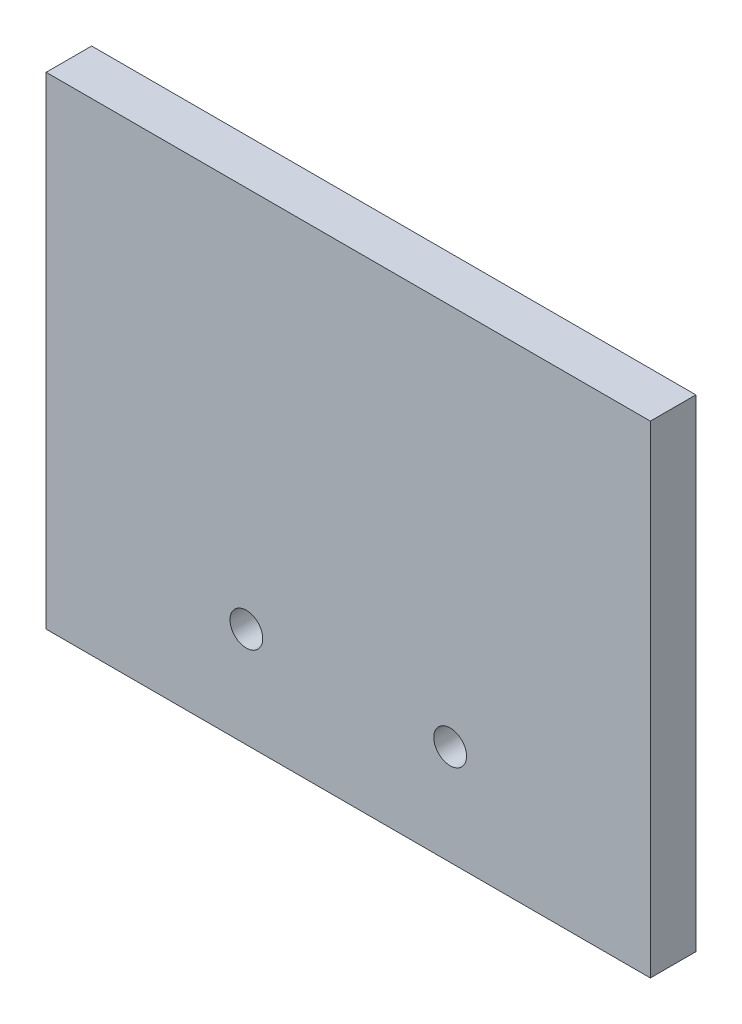
from build123d import *

# Parameters (mm, degrees)
SKETCH1_W                = 50
SKETCH1_H                = 9.1
BOSS_EXTRUDE1_DEPTH      = 2
SKETCH2_W                = 25
SKETCH2_H                = 6.6
CUT_EXTRUDE1_DEPTH       = 2
SKETCH3_R                = 1.8
CUT_EXTRUDE2_DEPTH       = 2
SKETCH4_W                = 66.4
SKETCH4_H                = 130
BOSS_EXTRUDE2_DEPTH      = 2
SKETCH5_W                = 66.4
SKETCH5_H                = 2
BOSS_EXTRUDE3_DEPTH      = 2.5
SKETCH6_W                = 8.6
SKETCH6_H                = 62.5
BOSS_EXTRUDE4_DEPTH      = 2
SKETCH7_R                = 1.8
SKETCH7_W                = 3
SKETCH7_H                = 5
CUT_EXTRUDE3_DEPTH       = 2
SKETCH8_W                = 25
SKETCH8_H                = 45
CUT_EXTRUDE4_DEPTH       = 20
SKETCH9_W                = 25
SKETCH9_H                = 10
BOSS_EXTRUDE5_DEPTH      = 2
SKETCH10_W               = 34.7
SKETCH10_H               = 27.07
BOSS_EXTRUDE6_DEPTH      = 2
SKETCH11_R               = 1.8
CUT_EXTRUDE5_DEPTH       = 2
SKETCH12_R               = 1.8
CUT_EXTRUDE6_DEPTH       = 2
SKETCH13_W               = 2
SKETCH13_H               = 2
BOSS_EXTRUDE7_DEPTH      = 44
SKETCH14_W               = 2
SKETCH14_H               = 2
BOSS_EXTRUDE8_DEPTH      = 46
SKETCH16_W               = 42
SKETCH16_H               = 43
BOSS_EXTRUDE10_DEPTH     = 2
SKETCH18_R               = 1.8
CUT_EXTRUDE7_DEPTH       = 2
BOSS_EXTRUDE12_DEPTH     = 2
SKETCH21_W               = 2
SKETCH21_H               = 2
BOSS_EXTRUDE13_DEPTH     = 10
SKETCH25_W               = 3
SKETCH25_H               = 5
CUT_EXTRUDE8_DEPTH       = 10
SKETCH26_W               = 6.2
SKETCH26_H               = 13
SKETCH26_W_2             = 21
SKETCH26_H_2             = 6.6
BOSS_EXTRUDE14_DEPTH     = 2
SKETCH27_W               = 2
SKETCH27_H               = 27
SKETCH27_H_2             = 24.93
BOSS_EXTRUDE15_DEPTH     = 2
SKETCH29_W               = 10
SKETCH29_H               = 10
BOSS_EXTRUDE19_DEPTH     = 2
SKETCH41_R               = 1.8
CUT_EXTRUDE15_DEPTH      = 2
BOSS_EXTRUDE26_DEPTH     = 2
SKETCH43_W               = 70.4
SKETCH43_H               = 2
BOSS_EXTRUDE27_DEPTH     = 11
SKETCH44_W               = 10
SKETCH44_H               = 5
BOSS_EXTRUDE28_DEPTH     = 2
SKETCH45_R               = 1.8
BOSS_EXTRUDE29_DEPTH     = 2
SKETCH46_R               = 1.8
CUT_EXTRUDE16_DEPTH      = 2
SKETCH47_W               = 10
SKETCH47_H               = 1
BOSS_EXTRUDE30_DEPTH     = 2
SKETCH48_W               = 32.7
SKETCH48_H               = 31.07
SKETCH48_W_2             = 101.75
SKETCH48_H_2             = 120.487369876
CUT_EXTRUDE17_DEPTH      = 20
SKETCH50_W               = 66.4
SKETCH50_H               = 81.07
CUT_EXTRUDE19_DEPTH      = 20
SKETCH51_W               = 70.4
SKETCH51_H               = 85.07
SKETCH51_W_2             = 66.4
SKETCH51_H_2             = 81.07
BOSS_EXTRUDE31_DEPTH     = 20
SKETCH52_W               = 10
SKETCH52_H               = 1
BOSS_EXTRUDE32_DEPTH     = 2
SKETCH53_W               = 10
SKETCH53_H               = 4
CUT_EXTRUDE20_DEPTH      = 2
BOSS_EXTRUDE33_START     = 1
SKETCH54_W               = 10
SKETCH54_H               = 12
SKETCH54_R               = 1.8
BOSS_EXTRUDE33_DEPTH     = 1
CUT_EXTRUDE23_DEPTH      = 96
CUT_EXTRUDE23_DEPTH_BACK = 16
SKETCH59_R               = 1.8
SKETCH62_W               = 66.985033768
SKETCH62_H               = 11.249394984
BOSS_EXTRUDE38_DEPTH     = 1
SKETCH65_R               = 1.8
CUT_EXTRUDE27_DEPTH      = 3
SKETCH66_R               = 1
CUT_EXTRUDE28_DEPTH      = 87
BOSS_EXTRUDE41_DEPTH     = 2
BOSS_EXTRUDE42_DEPTH     = 2
BOSS_EXTRUDE43_DEPTH     = 2
SKETCH68_W               = 6.791832398
SKETCH68_H               = 8.144168394
SKETCH68_W_2             = 5.485710784
SKETCH68_W_3             = 7.764004839
SKETCH68_H_2             = 11.628907231
BOSS_EXTRUDE44_DEPTH     = 2
BOSS_EXTRUDE45_DEPTH     = 2
SKETCH70_R               = 1.8
CUT_EXTRUDE29_DEPTH      = 83
SKETCH72_W               = 109.694125273
SKETCH72_H               = 49.124079095
CUT_EXTRUDE30_DEPTH      = 90
SKETCH73_W               = 16.906531278
SKETCH73_H               = 38.825332728
SKETCH73_W_2             = 13.856512057
SKETCH73_H_2             = 35.444026473
CUT_EXTRUDE31_DEPTH      = 90
SKETCH74_W               = 66.4
SKETCH74_H               = 2
BOSS_EXTRUDE46_DEPTH     = 31
BOSS_EXTRUDE47_START     = 3
SKETCH75_W               = 66.4
SKETCH75_H               = 53
SKETCH75_R               = 1.8
BOSS_EXTRUDE47_DEPTH     = 3


with BuildPart() as part:
    # Sketch1 → Boss-Extrude1 (new body)
    with BuildSketch(Plane(origin=(0, 0, 0), x_dir=(1, 0, 0), z_dir=(0, 1, 0))):
        with Locations((25, 4.55)):
            Rectangle(SKETCH1_W, SKETCH1_H)
    extrude(amount=BOSS_EXTRUDE1_DEPTH)

    # Sketch2 → Cut-Extrude1 (cut)
    with BuildSketch(Plane(origin=(0, 2, 0), x_dir=(1, 0, 0), z_dir=(0, 1, 0))):
        with Locations((25, 5.8)):
            Rectangle(SKETCH2_W, SKETCH2_H)
    extrude(amount=-CUT_EXTRUDE1_DEPTH, mode=Mode.SUBTRACT)

    # Sketch3 → Cut-Extrude2 (cut)
    with BuildSketch(Plane(origin=(0, 2, 0), x_dir=(1, 0, 0), z_dir=(0, 1, 0))):
        with Locations(Location((6.25, 5.8, 0), (0, 0, 270))):
            Circle(SKETCH3_R)
        with Locations(Location((43.75, 5.8, 0), (0, 0, 270))):
            Circle(SKETCH3_R)
    extrude(amount=-CUT_EXTRUDE2_DEPTH, mode=Mode.SUBTRACT)

    # Sketch4 → Boss-Extrude2 (add)
    with BuildSketch(Plane(origin=(0, 2, 0), x_dir=(1, 0, 0), z_dir=(0, 1, 0))):
        with Locations((25, -65)):
            Rectangle(SKETCH4_W, SKETCH4_H)
    extrude(amount=-BOSS_EXTRUDE2_DEPTH)

    # Sketch5 → Boss-Extrude3 (add)
    with BuildSketch(Plane.XY.offset(130)):
        with Locations((25, 1)):
            Rectangle(SKETCH5_W, SKETCH5_H)
    extrude(amount=BOSS_EXTRUDE3_DEPTH)

    # Sketch6 → Boss-Extrude4 (add)
    with BuildSketch(Plane(origin=(0, 2, 0), x_dir=(1, 0, 0), z_dir=(0, 1, 0))):
        with Locations((-12.5, -101.25)):
            Rectangle(SKETCH6_W, SKETCH6_H)
        with Locations((62.5, -101.25)):
            Rectangle(SKETCH6_W, SKETCH6_H)
    extrude(amount=-BOSS_EXTRUDE4_DEPTH)

    # Sketch7 → Cut-Extrude3 (cut)
    with BuildSketch(Plane(origin=(0, 2, 0), x_dir=(1, 0, 0), z_dir=(0, 1, 0))):
        with Locations(Location((-13.5, -77, 0), (0, 0, 270))):
            Circle(SKETCH7_R)
        with Locations(Location((-13.5, -101.25, 0), (0, 0, 270))):
            Circle(SKETCH7_R)
        with Locations(Location((-13.5, -125.5, 0), (0, 0, 270))):
            Circle(SKETCH7_R)
        with Locations(Location((63.5, -77, 0), (0, 0, 270))):
            Circle(SKETCH7_R)
        with Locations(Location((63.5, -101.25, 0), (0, 0, 270))):
            Circle(SKETCH7_R)
        with Locations(Location((63.5, -125.5, 0), (0, 0, 270))):
            Circle(SKETCH7_R)
        with Locations((-13.5, -117.5)):
            Rectangle(SKETCH7_W, SKETCH7_H)
        with Locations((63.5, -117.5)):
            Rectangle(SKETCH7_W, SKETCH7_H)
    extrude(amount=-CUT_EXTRUDE3_DEPTH, mode=Mode.SUBTRACT)

    # Sketch8 → Cut-Extrude4 (cut)
    with BuildSketch(Plane(origin=(0, 2, 0), x_dir=(1, 0, 0), z_dir=(0, 1, 0))):
        with Locations((25, -22.5)):
            Rectangle(SKETCH8_W, SKETCH8_H)
    extrude(amount=-CUT_EXTRUDE4_DEPTH, mode=Mode.SUBTRACT)

    # Sketch9 → Boss-Extrude5 (add)
    with BuildSketch(Plane(origin=(0, 2, 0), x_dir=(1, 0, 0), z_dir=(0, 1, 0))):
        with Locations((25, -5)):
            Rectangle(SKETCH9_W, SKETCH9_H)
    extrude(amount=-BOSS_EXTRUDE5_DEPTH)

    # Sketch10 → Boss-Extrude6 (add)
    with BuildSketch(Plane(origin=(0, 2, 0), x_dir=(1, 0, 0), z_dir=(0, 1, 0))):
        with Locations((-25.55, -29.535)):
            Rectangle(SKETCH10_W, SKETCH10_H)
        with Locations((75.55, -29.535)):
            Rectangle(SKETCH10_W, SKETCH10_H)
    extrude(amount=-BOSS_EXTRUDE6_DEPTH)

    # Sketch11 → Cut-Extrude5 (cut)
    with BuildSketch(Plane(origin=(0, 2, 0), x_dir=(1, 0, 0), z_dir=(0, 1, 0))):
        with Locations(Location((-36.9, -19.25, 0), (0, 0, 270))):
            Circle(SKETCH11_R)
        with Locations(Location((-36.9, -39.82, 0), (0, 0, 270))):
            Circle(SKETCH11_R)
        with Locations(Location((-22.6, -19.25, 0), (0, 0, 270))):
            Circle(SKETCH11_R)
        with Locations(Location((-22.6, -39.82, 0), (0, 0, 270))):
            Circle(SKETCH11_R)
    extrude(amount=-CUT_EXTRUDE5_DEPTH, mode=Mode.SUBTRACT)

    # Sketch12 → Cut-Extrude6 (cut)
    with BuildSketch(Plane(origin=(0, 2, 0), x_dir=(1, 0, 0), z_dir=(0, 1, 0))):
        with Locations(Location((72.6, -19.25, 0), (0, 0, 270))):
            Circle(SKETCH12_R)
        with Locations(Location((86.9, -19.25, 0), (0, 0, 270))):
            Circle(SKETCH12_R)
        with Locations(Location((72.6, -39.82, 0), (0, 0, 270))):
            Circle(SKETCH12_R)
        with Locations(Location((86.9, -39.82, 0), (0, 0, 270))):
            Circle(SKETCH12_R)
    extrude(amount=-CUT_EXTRUDE6_DEPTH, mode=Mode.SUBTRACT)

    # Sketch13 → Boss-Extrude7 (add)
    with BuildSketch(Plane.ZY.offset(42.9)):
        with Locations((15, 1)):
            Rectangle(SKETCH13_W, SKETCH13_H)
        with Locations((44.07, 1)):
            Rectangle(SKETCH13_W, SKETCH13_H)
    extrude(amount=-BOSS_EXTRUDE7_DEPTH)

    # Sketch14 → Boss-Extrude8 (add)
    with BuildSketch(Plane(origin=(92.9, 0, 0), x_dir=(0, 0, -1), z_dir=(1, 0, 0))):
        with Locations((-15, 1)):
            Rectangle(SKETCH14_W, SKETCH14_H)
        with Locations((-44.07, 1)):
            Rectangle(SKETCH14_W, SKETCH14_H)
    extrude(amount=-BOSS_EXTRUDE8_DEPTH)

    # Sketch16 → Boss-Extrude10 (add)
    with BuildSketch(Plane(origin=(0, 2, 0), x_dir=(1, 0, 0), z_dir=(0, 1, 0))):
        with Locations((25, -154)):
            Rectangle(SKETCH16_W, SKETCH16_H)
    extrude(amount=-BOSS_EXTRUDE10_DEPTH)

    # Sketch18 → Cut-Extrude7 (cut)
    with BuildSketch(Plane(origin=(0, 2, 0), x_dir=(1, 0, 0), z_dir=(0, 1, 0))):
        with Locations(Location((8.74, -171.03, 0), (0, 0, 270))):
            Circle(SKETCH18_R)
        with Locations(Location((41.26, -171.03, 0), (0, 0, 270))):
            Circle(SKETCH18_R)
        with Locations(Location((8.74, -138.5, 0), (0, 0, 270))):
            Circle(SKETCH18_R)
        with Locations(Location((41.26, -138.5, 0), (0, 0, 270))):
            Circle(SKETCH18_R)
    extrude(amount=-CUT_EXTRUDE7_DEPTH, mode=Mode.SUBTRACT)

    # Sketch20 → Boss-Extrude12 (add)
    with BuildSketch(Plane(origin=(0, 2, 0), x_dir=(1, 0, 0), z_dir=(0, 1, 0))):
        with BuildLine():
            Line((-2, -132.5), (4, -132.5))
            Line((4, -132.5), (4, -138.5))
            ThreePointArc((4, -138.5), (2.242640687, -134.257359313), (-2, -132.5))
        make_face()
        with BuildLine():
            ThreePointArc((52, -132.5), (47.757359313, -134.257359313), (46, -138.5))
            Line((46, -138.5), (46, -132.5))
            Line((46, -132.5), (52, -132.5))
        make_face()
    extrude(amount=-BOSS_EXTRUDE12_DEPTH)

    # Sketch21 → Boss-Extrude13 (add)
    with BuildSketch(Plane(origin=(0, 0, -9.1), x_dir=(-1, 0, 0), z_dir=(0, 0, -1))):
        with Locations((-51, 1)):
            Rectangle(SKETCH21_W, SKETCH21_H)
        with Locations((-36.5, 1)):
            Rectangle(SKETCH21_W, SKETCH21_H)
        with Locations((-13.5, 1)):
            Rectangle(SKETCH21_W, SKETCH21_H)
        with Locations((1, 1)):
            Rectangle(SKETCH21_W, SKETCH21_H)
    extrude(amount=-BOSS_EXTRUDE13_DEPTH)

    # Sketch25 → Cut-Extrude8 (cut)
    with BuildSketch(Plane(origin=(0, 2, 0), x_dir=(1, 0, 0), z_dir=(0, 1, 0))):
        with Locations((-11.7, -22.5)):
            Rectangle(SKETCH25_W, SKETCH25_H)
        with Locations((-11.7, -36.57)):
            Rectangle(SKETCH25_W, SKETCH25_H)
        with Locations((61.7, -22.5)):
            Rectangle(SKETCH25_W, SKETCH25_H)
        with Locations((61.7, -36.57)):
            Rectangle(SKETCH25_W, SKETCH25_H)
    extrude(amount=-CUT_EXTRUDE8_DEPTH, mode=Mode.SUBTRACT)

    # Sketch26 → Boss-Extrude14 (add)
    with BuildSketch(Plane(origin=(0, 2, 0), x_dir=(1, 0, 0), z_dir=(0, 1, 0))):
        with Locations((-5.1, 6.5)):
            Rectangle(SKETCH26_W, SKETCH26_H)
        Polygon((-2, 13), (-2, 9.1), (14.5, 9.1), (35.5, 9.1), (52, 9.1), (52, 13), align=None)
        with Locations((25, 5.8)):
            Rectangle(SKETCH26_W_2, SKETCH26_H_2)
        with Locations((55.1, 6.5)):
            Rectangle(SKETCH26_W, SKETCH26_H)
    extrude(amount=-BOSS_EXTRUDE14_DEPTH)

    # Sketch27 → Boss-Extrude15 (add)
    with BuildSketch(Plane(origin=(0, 2, 0), x_dir=(1, 0, 0), z_dir=(0, 1, 0))):
        with Locations((-9.2, -0.5)):
            Rectangle(SKETCH27_W, SKETCH27_H)
        with Locations((-9.2, -57.535)):
            Rectangle(SKETCH27_W, SKETCH27_H_2)
        with Locations((59.2, -0.5)):
            Rectangle(SKETCH27_W, SKETCH27_H)
        with Locations((59.2, -57.535)):
            Rectangle(SKETCH27_W, SKETCH27_H_2)
    extrude(amount=-BOSS_EXTRUDE15_DEPTH)

    # Sketch29 → Boss-Extrude19 (add)
    with BuildSketch(Plane(origin=(0, 2, 0), x_dir=(1, 0, 0), z_dir=(0, 1, 0))):
        with Locations((-15.2, -9)):
            Rectangle(SKETCH29_W, SKETCH29_H)
        with Locations((-15.2, -50.07)):
            Rectangle(SKETCH29_W, SKETCH29_H)
        with Locations((65.2, -9)):
            Rectangle(SKETCH29_W, SKETCH29_H)
        with Locations((65.2, -50.07)):
            Rectangle(SKETCH29_W, SKETCH29_H)
    extrude(amount=-BOSS_EXTRUDE19_DEPTH)

    # Sketch41 → Cut-Extrude15 (cut)
    with BuildSketch(Plane(origin=(0, 2, 0), x_dir=(1, 0, 0), z_dir=(0, 1, 0))):
        with Locations(Location((-15.2, -9, 0), (0, 0, 270))):
            Circle(SKETCH41_R)
        with Locations(Location((-15.2, -50.07, 0), (0, 0, 270))):
            Circle(SKETCH41_R)
        with Locations(Location((65.2, -9, 0), (0, 0, 270))):
            Circle(SKETCH41_R)
        with Locations(Location((65.2, -50.07, 0), (0, 0, 270))):
            Circle(SKETCH41_R)
    extrude(amount=-CUT_EXTRUDE15_DEPTH, mode=Mode.SUBTRACT)

    # Sketch42 → Boss-Extrude26 (add)
    with BuildSketch(Plane(origin=(0, 2, 0), x_dir=(1, 0, 0), z_dir=(0, 1, 0))):
        with BuildLine():
            Line((-16.8, -70), (-10.2, -70))
            Line((-10.2, -70), (-10.2, -63.4))
            ThreePointArc((-10.2, -63.4), (-12.133095244, -68.066904756), (-16.8, -70))
        make_face()
        with BuildLine():
            Line((60.2, -63.4), (60.2, -70))
            Line((60.2, -70), (66.8, -70))
            ThreePointArc((66.8, -70), (62.133095244, -68.066904756), (60.2, -63.4))
        make_face()
    extrude(amount=-BOSS_EXTRUDE26_DEPTH)

    # Sketch43 → Boss-Extrude27 (add)
    with BuildSketch(Plane(origin=(0, 0, -13), x_dir=(-1, 0, 0), z_dir=(0, 0, -1))):
        with Locations((-25, 1)):
            Rectangle(SKETCH43_W, SKETCH43_H)
    extrude(amount=BOSS_EXTRUDE27_DEPTH)

    # Sketch44 → Boss-Extrude28 (add)
    with BuildSketch(Plane(origin=(0, 2, 0), x_dir=(1, 0, 0), z_dir=(0, 1, 0))):
        with Locations((-15.2, -57.57)):
            Rectangle(SKETCH44_W, SKETCH44_H)
        with Locations((65.2, -57.57)):
            Rectangle(SKETCH44_W, SKETCH44_H)
    extrude(amount=-BOSS_EXTRUDE28_DEPTH)

    # Sketch45 → Boss-Extrude29 (add)
    with BuildSketch(Plane(origin=(0, 2, 0), x_dir=(1, 0, 0), z_dir=(0, 1, 0))):
        with Locations((-15.2, -50.07)):
            Circle(SKETCH45_R)
        with Locations((65.2, -50.07)):
            Circle(SKETCH45_R)
    extrude(amount=-BOSS_EXTRUDE29_DEPTH)

    # Sketch46 → Cut-Extrude16 (cut)
    with BuildSketch(Plane(origin=(0, 2, 0), x_dir=(1, 0, 0), z_dir=(0, 1, 0))):
        with Locations(Location((-15.2, -55.07, 0), (0, 0, 270))):
            Circle(SKETCH46_R)
        with Locations(Location((65.2, -55.07, 0), (0, 0, 270))):
            Circle(SKETCH46_R)
    extrude(amount=-CUT_EXTRUDE16_DEPTH, mode=Mode.SUBTRACT)

    # Sketch47 → Boss-Extrude30 (add)
    with BuildSketch(Plane(origin=(0, 2, 0), x_dir=(1, 0, 0), z_dir=(0, 1, 0))):
        with Locations((-15.2, -3.5)):
            Rectangle(SKETCH47_W, SKETCH47_H)
        with Locations((-15.2, -60.57)):
            Rectangle(SKETCH47_W, SKETCH47_H)
        with Locations((65.2, -3.5)):
            Rectangle(SKETCH47_W, SKETCH47_H)
        with Locations((65.2, -60.57)):
            Rectangle(SKETCH47_W, SKETCH47_H)
    extrude(amount=-BOSS_EXTRUDE30_DEPTH)

    # Sketch48 → Cut-Extrude17 (cut)
    with BuildSketch(Plane(origin=(0, 2, 0), x_dir=(1, 0, 0), z_dir=(0, 1, 0))):
        with Locations((-26.55, -29.535)):
            Rectangle(SKETCH48_W, SKETCH48_H)
        with Locations((76.55, -29.535)):
            Rectangle(SKETCH48_W, SKETCH48_H)
        with Locations((30.675, -121.313684938)):
            Rectangle(SKETCH48_W_2, SKETCH48_H_2)
    extrude(amount=-CUT_EXTRUDE17_DEPTH, mode=Mode.SUBTRACT)

    # Sketch50 → Cut-Extrude19 (cut)
    with BuildSketch(Plane(origin=(0, 2, 0), x_dir=(1, 0, 0), z_dir=(0, 1, 0))):
        with Locations((25, -18.535)):
            Rectangle(SKETCH50_W, SKETCH50_H)
    extrude(amount=-CUT_EXTRUDE19_DEPTH, mode=Mode.SUBTRACT)

    # Sketch51 → Boss-Extrude31 (add)
    with BuildSketch(Plane(origin=(0, 2, 0), x_dir=(1, 0, 0), z_dir=(0, 1, 0))):
        with Locations((25, -18.535)):
            Rectangle(SKETCH51_W, SKETCH51_H)
        with Locations((25, -18.535)):
            Rectangle(SKETCH51_W_2, SKETCH51_H_2, mode=Mode.SUBTRACT)
    extrude(amount=BOSS_EXTRUDE31_DEPTH)

    # Sketch52 → Boss-Extrude32 (add)
    with BuildSketch(Plane(origin=(0, 2, 0), x_dir=(1, 0, 0), z_dir=(0, 1, 0))):
        with Locations((-15.2, -14.5)):
            Rectangle(SKETCH52_W, SKETCH52_H)
        with Locations((65.2, -14.5)):
            Rectangle(SKETCH52_W, SKETCH52_H)
    extrude(amount=-BOSS_EXTRUDE32_DEPTH)

    # Sketch53 → Cut-Extrude20 (cut)
    with BuildSketch(Plane(origin=(0, 2, 0), x_dir=(1, 0, 0), z_dir=(0, 1, 0))):
        with Locations((-15.2, -47.07)):
            Rectangle(SKETCH53_W, SKETCH53_H)
        with Locations((65.2, -47.07)):
            Rectangle(SKETCH53_W, SKETCH53_H)
    extrude(amount=-CUT_EXTRUDE20_DEPTH, mode=Mode.SUBTRACT)

    # Sketch54 → Boss-Extrude33 (add)
    # profile 1 of 4: a face of its own
    with BuildSketch(Plane(origin=(0, 2, 0), x_dir=(1, 0, 0), z_dir=(0, 1, 0)).offset(BOSS_EXTRUDE33_START)):
        with Locations((-15.2, -9)):
            Rectangle(SKETCH54_W, SKETCH54_H)
        with Locations(Location((-15.2, -9, 0), (0, 0, 270))):
            Circle(SKETCH54_R, mode=Mode.SUBTRACT)
    # profile 2 of 4: a face of its own
    with BuildSketch(Plane(origin=(0, 2, 0), x_dir=(1, 0, 0), z_dir=(0, 1, 0)).offset(BOSS_EXTRUDE33_START)):
        with Locations((-15.2, -55.07)):
            Rectangle(SKETCH54_W, SKETCH54_H)
        with Locations(Location((-15.2, -55.07, 0), (0, 0, 270))):
            Circle(SKETCH54_R, mode=Mode.SUBTRACT)
    # profile 3 of 4: a face of its own
    with BuildSketch(Plane(origin=(0, 2, 0), x_dir=(1, 0, 0), z_dir=(0, 1, 0)).offset(BOSS_EXTRUDE33_START)):
        with Locations((65.2, -9)):
            Rectangle(SKETCH54_W, SKETCH54_H)
        with Locations(Location((65.2, -9, 0), (0, 0, 270))):
            Circle(SKETCH54_R, mode=Mode.SUBTRACT)
    # profile 4 of 4: a face of its own
    with BuildSketch(Plane(origin=(0, 2, 0), x_dir=(1, 0, 0), z_dir=(0, 1, 0)).offset(BOSS_EXTRUDE33_START)):
        with Locations((65.2, -55.07)):
            Rectangle(SKETCH54_W, SKETCH54_H)
        with Locations(Location((65.2, -55.07, 0), (0, 0, 270))):
            Circle(SKETCH54_R, mode=Mode.SUBTRACT)
    extrude(amount=-BOSS_EXTRUDE33_DEPTH)

    # Sketch59 → Cut-Extrude23 (cut, two sides: drawn at the far end of the back side and taken through both)
    with BuildSketch(Plane.XY.offset(-22).offset(-CUT_EXTRUDE23_DEPTH_BACK)):
        with Locations((-3.2, 11)):
            Circle(SKETCH59_R)
        with Locations((53.2, 11)):
            Circle(SKETCH59_R)
        with Locations((25, 11)):
            Circle(SKETCH59_R)
    extrude(amount=CUT_EXTRUDE23_DEPTH + CUT_EXTRUDE23_DEPTH_BACK, mode=Mode.SUBTRACT)

    # Sketch62 → Boss-Extrude38 (add)
    with BuildSketch(Plane.XY.offset(61.07)):
        with Locations((24.914777311, 10.744331932)):
            Rectangle(SKETCH62_W, SKETCH62_H)
    extrude(amount=-BOSS_EXTRUDE38_DEPTH)

    # Sketch65 → Cut-Extrude27 (cut)
    with BuildSketch(Plane(origin=(0, 0, 59.07), x_dir=(-1, 0, 0), z_dir=(0, 0, -1))):
        with Locations((-13.8, 11)):
            Circle(SKETCH65_R)
        with Locations((-36.2, 11)):
            Circle(SKETCH65_R)
    extrude(amount=-CUT_EXTRUDE27_DEPTH, mode=Mode.SUBTRACT)

    # Sketch66 → Cut-Extrude28 (cut)
    with BuildSketch(Plane.ZY.offset(10.2)):
        with Locations((32.035, 16)):
            Circle(SKETCH66_R)
    extrude(amount=-CUT_EXTRUDE28_DEPTH, mode=Mode.SUBTRACT)

    # Sketch55 → Boss-Extrude41 (add)
    with BuildSketch(Plane(origin=(0, 0, 3), x_dir=(-1, 0, 0), z_dir=(0, 0, -1))):
        Polygon((20.2, 3), (10.2, 22), (10.2, 3), align=None)
        Polygon((-70.2, 3), (-60.2, 3), (-60.2, 22), align=None)
    extrude(amount=-BOSS_EXTRUDE41_DEPTH)

    # Sketch56 → Boss-Extrude42 (add)
    with BuildSketch(Plane.XY.offset(15)):
        Polygon((-20.2, 3), (-10.2, 3), (-10.2, 22), align=None)
        Polygon((70.2, 3), (60.2, 3), (60.2, 22), align=None)
    extrude(amount=-BOSS_EXTRUDE42_DEPTH)

    # Sketch57 → Boss-Extrude43 (add)
    with BuildSketch(Plane(origin=(0, 0, 49.07), x_dir=(-1, 0, 0), z_dir=(0, 0, -1))):
        Polygon((20.2, 3), (10.2, 3), (10.2, 22), align=None)
        Polygon((-70.2, 3), (-60.2, 3), (-60.2, 22), align=None)
    extrude(amount=-BOSS_EXTRUDE43_DEPTH)

    # Sketch68 → Boss-Extrude44 (add)
    with BuildSketch(Plane(origin=(0, 0, 59.07), x_dir=(-1, 0, 0), z_dir=(0, 0, -1))):
        with Locations((2.499419559, 10.346452983)):
            Rectangle(SKETCH68_W, SKETCH68_H)
        with Locations((-24.624372648, 10.346452983)):
            Rectangle(SKETCH68_W_2, SKETCH68_H)
        with Locations((-52.231743322, 12.088822401)):
            Rectangle(SKETCH68_W_3, SKETCH68_H_2)
    extrude(amount=-BOSS_EXTRUDE44_DEPTH)

    # Sketch69 → Boss-Extrude45 (add)
    with BuildSketch(Plane.XY.offset(61.07)):
        Polygon((-20.2, 3), (-10.2, 3), (-10.2, 22), align=None)
        Polygon((60.2, 3), (70.2, 3), (60.2, 22), align=None)
    extrude(amount=-BOSS_EXTRUDE45_DEPTH)

    # Sketch70 → Cut-Extrude29 (cut)
    with BuildSketch(Plane.ZY.offset(10.2)):
        with Locations((9, 17)):
            Circle(SKETCH70_R)
        with Locations((55.07, 17)):
            Circle(SKETCH70_R)
    extrude(amount=-CUT_EXTRUDE29_DEPTH, mode=Mode.SUBTRACT)

    # Sketch72 → Cut-Extrude30 (cut)
    with BuildSketch(Plane(origin=(0, 0, 59.07), x_dir=(-1, 0, 0), z_dir=(0, 0, -1))):
        with Locations((-21.065003352, -2.562039548)):
            Rectangle(SKETCH72_W, SKETCH72_H)
    extrude(amount=CUT_EXTRUDE30_DEPTH, mode=Mode.SUBTRACT)

    # Sketch73 → Cut-Extrude31 (cut)
    with BuildSketch(Plane(origin=(0, 0, 59.07), x_dir=(-1, 0, 0), z_dir=(0, 0, -1))):
        with Locations((16.653265639, 2.587333636)):
            Rectangle(SKETCH73_W, SKETCH73_H)
        with Locations((-65.128256029, 4.277986763)):
            Rectangle(SKETCH73_W_2, SKETCH73_H_2)
    extrude(amount=-CUT_EXTRUDE31_DEPTH, mode=Mode.SUBTRACT)

    # Sketch74 → Boss-Extrude46 (add)
    with BuildSketch(Plane(origin=(0, 22, 0), x_dir=(1, 0, 0), z_dir=(0, 1, 0))):
        with Locations((25, -60.07)):
            Rectangle(SKETCH74_W, SKETCH74_H)
    extrude(amount=BOSS_EXTRUDE46_DEPTH)

    # Sketch75 → Boss-Extrude47 (add)
    with BuildSketch(Plane(origin=(0, 0, 59.07), x_dir=(-1, 0, 0), z_dir=(0, 0, -1)).offset(BOSS_EXTRUDE47_START)):
        with Locations((-25, 26.5)):
            Rectangle(SKETCH75_W, SKETCH75_H)
        with Locations((-13.8, 11)):
            Circle(SKETCH75_R, mode=Mode.SUBTRACT)
        with Locations((-36.2, 11)):
            Circle(SKETCH75_R, mode=Mode.SUBTRACT)
    extrude(amount=-BOSS_EXTRUDE47_DEPTH)


solid = part.part
